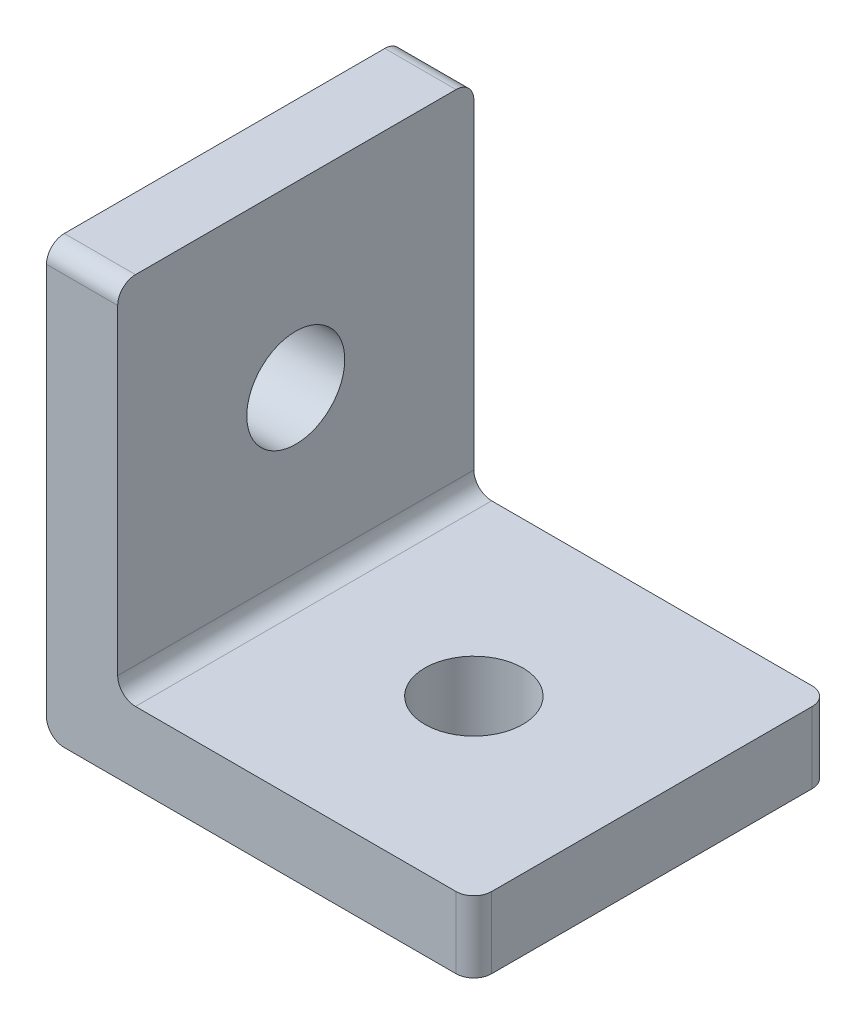
from build123d import *

# Parameters (mm, degrees)
SKETCH_1_W          = 24
SKETCH_1_H          = 4
SKETCH_1_W_2        = 4
SKETCH_1_H_2        = 20
EXTRUDE_1_DEPTH     = 20
SKETCH_2_R          = 2.75
CUT_EXTRUDE_1_DEPTH = 20
SKETCH_3_R          = 2.75
CUT_EXTRUDE_2_DEPTH = 20
FILLET_1_R          = 1


with BuildPart() as part:
    # 스케치1 → 보스-돌출1 (new body)
    with BuildSketch(Plane.XY):
        with Locations((12, -2)):
            Rectangle(SKETCH_1_W, SKETCH_1_H)
        with Locations((2, 10)):
            Rectangle(SKETCH_1_W_2, SKETCH_1_H_2)
    extrude(amount=EXTRUDE_1_DEPTH)

    # 스케치2 → 컷-돌출1 (cut)
    with BuildSketch(Plane(origin=(0, 0, 0), x_dir=(1, 0, 0), z_dir=(0, 1, 0))):
        with Locations(Location((14, -10, 0), (0, 0, 180))):
            Circle(SKETCH_2_R)
    extrude(amount=-CUT_EXTRUDE_1_DEPTH, mode=Mode.SUBTRACT)

    # 스케치3 → 컷-돌출2 (cut)
    with BuildSketch(Plane(origin=(4, 0, 0), x_dir=(0, 0, -1), z_dir=(1, 0, 0))):
        with Locations(Location((-10, 10, 0), (0, 0, 90))):
            Circle(SKETCH_3_R)
    extrude(amount=-CUT_EXTRUDE_2_DEPTH, mode=Mode.SUBTRACT)

    # 필렛1
    fillet_1_edges = [part.edges().sort_by_distance(p)[0] for p in [
        (24, -2, 0),
        (0, -4, 10),
        (4, 0, 10),
        (2, 20, 20),
        (24, -2, 20),
        (2, 20, 0),
    ]]
    fillet(fillet_1_edges, radius=FILLET_1_R)


solid = part.part
